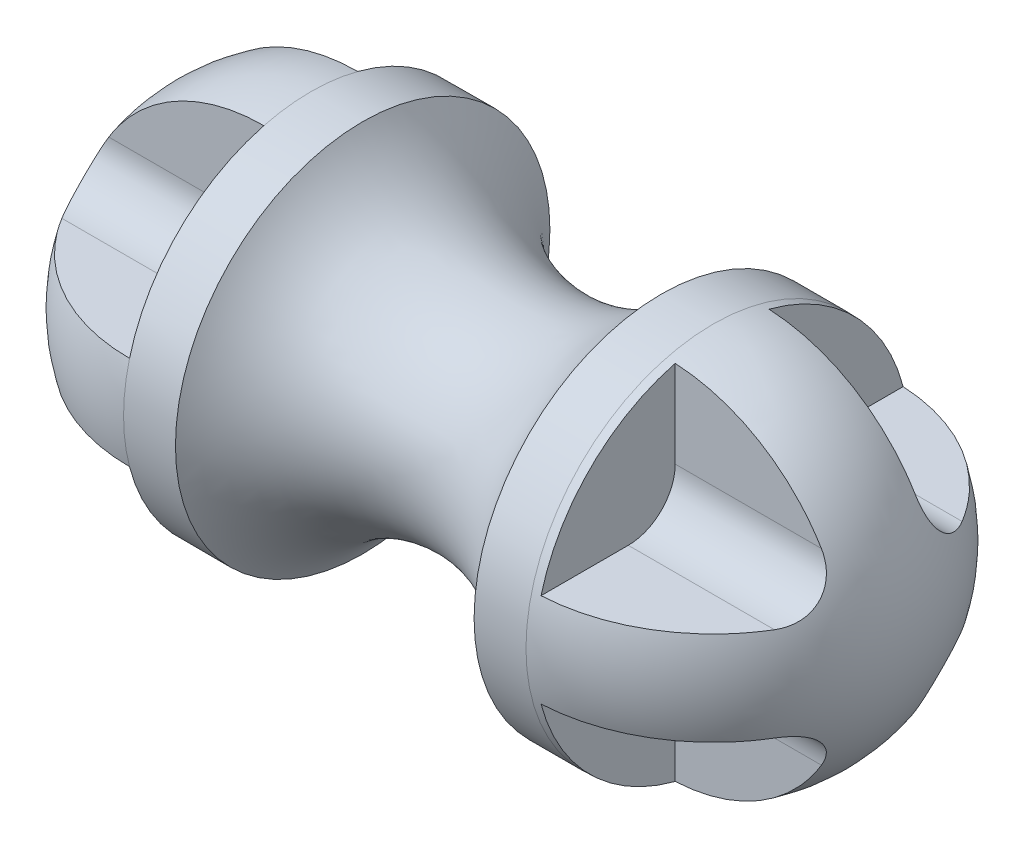
from build123d import *

# Parameters (mm, degrees)
CUT_EXTRUDE1_DEPTH = 110


with BuildPart() as part:
    # Sketch1 → Revolve1 (revolve)
    with BuildSketch(Plane(origin=(0, 0, 0), x_dir=(1, 0, 0), z_dir=(0, 1, 0)), mode=Mode.PRIVATE) as revolve1_sk:
        with BuildLine():
            Line((-43.842141265, 39.917998991), (-32.781970874, 39.917998991))
            ThreePointArc((-32.781970874, 39.917998991), (-0.947206756, 22.460391682), (30.887557363, 39.917998991))
            Line((30.887557363, 39.917998991), (41.947727754, 39.917998991))
            ThreePointArc((41.947727754, 39.917998991), (70.174015532, 28.226287778), (81.865726745, 0))
            Line((81.865726745, 0), (-83.760140257, 0))
            ThreePointArc((-83.760140257, 0), (-72.068429044, 28.226287778), (-43.842141265, 39.917998991))
        make_face()
    revolve(revolve1_sk.sketch.rotate(Axis((-43.842141265, 0, 0), (1, 0, 0)), 180), axis=Axis((-43.842141265, 0, 0), (1, 0, 0)))

    # Sketch2 → Cut-Extrude1 (cut)
    with BuildSketch(Plane(origin=(-43.842141265, 0, 0), x_dir=(0, 0, -1), z_dir=(1, 0, 0))):
        with BuildLine():
            Line((-10, 38.645137385), (-10, 20))
            ThreePointArc((-10, 20), (-12.928932188, 12.928932188), (-20, 10))
            Line((-20, 10), (-38.645137385, 10))
            ThreePointArc((-38.645137385, 10), (-28.226287778, 28.226287778), (-10, 38.645137385))
        make_face()
        with BuildLine():
            Line((10, 38.645137385), (10, 20))
            ThreePointArc((10, 20), (12.928932188, 12.928932188), (20, 10))
            Line((20, 10), (38.645137385, 10))
            ThreePointArc((38.645137385, 10), (28.226287778, 28.226287778), (10, 38.645137385))
        make_face()
        with BuildLine():
            Line((-38.645137385, -10), (-20, -10))
            ThreePointArc((-20, -10), (-12.928932188, -12.928932188), (-10, -20))
            Line((-10, -20), (-10, -38.645137385))
            ThreePointArc((-10, -38.645137385), (-28.226287778, -28.226287778), (-38.645137385, -10))
        make_face()
        with BuildLine():
            Line((10, -20), (10, -38.645137385))
            ThreePointArc((10, -38.645137385), (28.226287778, -28.226287778), (38.645137385, -10))
            Line((38.645137385, -10), (20, -10))
            ThreePointArc((20, -10), (12.928932188, -12.928932188), (10, -20))
        make_face()
    cut_extrude1 = extrude(amount=-CUT_EXTRUDE1_DEPTH, mode=Mode.SUBTRACT)

    # Mirror1: Cut-Extrude1 across plane
    add(cut_extrude1.mirror(Plane(origin=(0, 0, 0), x_dir=(0, 0, 1), z_dir=(1, 0, 0))), mode=Mode.SUBTRACT)


solid = part.part
